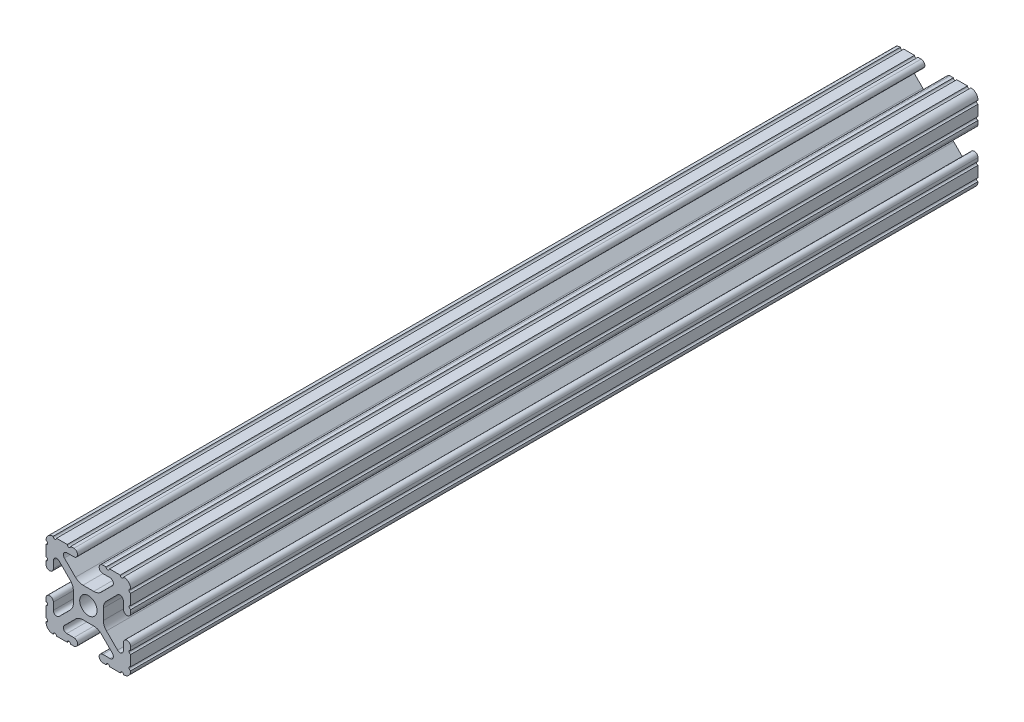
from build123d import *

# Parameters (mm, degrees)
SKETCH1_R           = 2.6035
BOSS_EXTRUDE1_DEPTH = 254


with BuildPart() as part:
    # Sketch1 → Boss-Extrude1 (new body)
    with BuildSketch(Plane(origin=(0, 0, -101.6), x_dir=(-1, 0, 0), z_dir=(0, 0, -1))):
        with BuildLine():
            Line((12.7, -9.5504), (12.7, -6.3330836))
            ThreePointArc((12.7, -6.3330836), (12.192, -5.8250836), (12.7, -5.3170836))
            Line((12.7, -5.3170836), (12.7, -4.3434))
            ThreePointArc((12.7, -4.3434), (11.5951, -3.2385), (10.4902, -4.3434))
            Line((10.4902, -4.3434), (10.4902, -6.474794456))
            ThreePointArc((10.4902, -6.474794456), (9.863006367, -7.413456061), (8.75577951, -7.193214945))
            Line((8.75577951, -7.193214945), (5.42573597, -3.863171405))
            ThreePointArc((5.42573597, -3.863171405), (4.737482484, -2.833127272), (4.4958, -1.618107374))
            Line((4.4958, -1.618107374), (4.4958, 1.618107374))
            ThreePointArc((4.4958, 1.618107374), (4.737482484, 2.833127272), (5.42573597, 3.863171405))
            Line((5.42573597, 3.863171405), (8.75577951, 7.193214945))
            ThreePointArc((8.75577951, 7.193214945), (9.863006367, 7.413456061), (10.4902, 6.474794456))
            Line((10.4902, 6.474794456), (10.4902, 4.343399971))
            ThreePointArc((10.4902, 4.343399971), (11.5951, 3.238499971), (12.7, 4.343399971))
            Line((12.7, 4.343399971), (12.7, 5.3170836))
            ThreePointArc((12.7, 5.3170836), (12.192, 5.8250836), (12.7, 6.3330836))
            Line((12.7, 6.3330836), (12.7, 9.5504))
            ThreePointArc((12.7, 9.5504), (12.192000006, 10.058323491), (12.699846982, 10.566399977))
            ThreePointArc((12.699846982, 10.566399977), (12.082522516, 12.082522516), (10.566399977, 12.699846982))
            ThreePointArc((10.566399977, 12.699846982), (10.058323491, 12.192000006), (9.5504, 12.7))
            Line((9.5504, 12.7), (6.3330836, 12.7))
            ThreePointArc((6.3330836, 12.7), (5.8250836, 12.192), (5.3170836, 12.7))
            Line((5.3170836, 12.7), (4.3434, 12.7))
            ThreePointArc((4.3434, 12.7), (3.2385, 11.5951), (4.3434, 10.4902))
            Line((4.3434, 10.4902), (6.474794456, 10.4902))
            ThreePointArc((6.474794456, 10.4902), (7.413456061, 9.863006367), (7.193214945, 8.75577951))
            Line((7.193214945, 8.75577951), (3.863171405, 5.42573597))
            ThreePointArc((3.863171405, 5.42573597), (2.833127272, 4.737482484), (1.618107374, 4.4958))
            Line((1.618107374, 4.4958), (-1.618107374, 4.4958))
            ThreePointArc((-1.618107374, 4.4958), (-2.833127272, 4.737482484), (-3.863171405, 5.42573597))
            Line((-3.863171405, 5.42573597), (-7.193214945, 8.75577951))
            ThreePointArc((-7.193214945, 8.75577951), (-7.413456061, 9.863006367), (-6.474794456, 10.4902))
            Line((-6.474794456, 10.4902), (-4.343399971, 10.4902))
            ThreePointArc((-4.343399971, 10.4902), (-3.238499971, 11.5951), (-4.343399971, 12.7))
            Line((-4.343399971, 12.7), (-5.3170836, 12.7))
            ThreePointArc((-5.3170836, 12.7), (-5.8250836, 12.192), (-6.3330836, 12.7))
            Line((-6.3330836, 12.7), (-9.5504, 12.7))
            ThreePointArc((-9.5504, 12.7), (-10.058323491, 12.192000006), (-10.566399977, 12.699846982))
            ThreePointArc((-10.566399977, 12.699846982), (-12.082522516, 12.082522516), (-12.699846982, 10.566399977))
            ThreePointArc((-12.699846982, 10.566399977), (-12.192000006, 10.058323491), (-12.7, 9.5504))
            Line((-12.7, 9.5504), (-12.7, 6.3330836))
            ThreePointArc((-12.7, 6.3330836), (-12.192, 5.8250836), (-12.7, 5.3170836))
            Line((-12.7, 5.3170836), (-12.7, 4.3434))
            ThreePointArc((-12.7, 4.3434), (-11.5951, 3.2385), (-10.4902, 4.3434))
            Line((-10.4902, 4.3434), (-10.4902, 6.474794456))
            ThreePointArc((-10.4902, 6.474794456), (-9.863006367, 7.413456061), (-8.75577951, 7.193214945))
            Line((-8.75577951, 7.193214945), (-5.42573597, 3.863171405))
            ThreePointArc((-5.42573597, 3.863171405), (-4.737482484, 2.833127272), (-4.4958, 1.618107374))
            Line((-4.4958, 1.618107374), (-4.4958, -1.618107374))
            ThreePointArc((-4.4958, -1.618107374), (-4.737482484, -2.833127272), (-5.42573597, -3.863171405))
            Line((-5.42573597, -3.863171405), (-8.75577951, -7.193214945))
            ThreePointArc((-8.75577951, -7.193214945), (-9.863006367, -7.413456061), (-10.4902, -6.474794456))
            Line((-10.4902, -6.474794456), (-10.4902, -4.343399971))
            ThreePointArc((-10.4902, -4.343399971), (-11.5951, -3.238499971), (-12.7, -4.343399971))
            Line((-12.7, -4.343399971), (-12.7, -5.3170836))
            ThreePointArc((-12.7, -5.3170836), (-12.192, -5.8250836), (-12.7, -6.3330836))
            Line((-12.7, -6.3330836), (-12.7, -9.5504))
            ThreePointArc((-12.7, -9.5504), (-12.192000006, -10.058323491), (-12.699846982, -10.566399977))
            ThreePointArc((-12.699846982, -10.566399977), (-12.082522516, -12.082522516), (-10.566399977, -12.699846982))
            ThreePointArc((-10.566399977, -12.699846982), (-10.058323491, -12.192000006), (-9.5504, -12.7))
            Line((-9.5504, -12.7), (-6.3330836, -12.7))
            ThreePointArc((-6.3330836, -12.7), (-5.8250836, -12.192), (-5.3170836, -12.7))
            Line((-5.3170836, -12.7), (-4.3434, -12.7))
            ThreePointArc((-4.3434, -12.7), (-3.2385, -11.5951), (-4.3434, -10.4902))
            Line((-4.3434, -10.4902), (-6.474794456, -10.4902))
            ThreePointArc((-6.474794456, -10.4902), (-7.413456061, -9.863006367), (-7.193214945, -8.75577951))
            Line((-7.193214945, -8.75577951), (-3.863171405, -5.42573597))
            ThreePointArc((-3.863171405, -5.42573597), (-2.833127272, -4.737482484), (-1.618107374, -4.4958))
            Line((-1.618107374, -4.4958), (1.618107374, -4.4958))
            ThreePointArc((1.618107374, -4.4958), (2.833127272, -4.737482484), (3.863171405, -5.42573597))
            Line((3.863171405, -5.42573597), (7.193214945, -8.75577951))
            ThreePointArc((7.193214945, -8.75577951), (7.413456061, -9.863006367), (6.474794456, -10.4902))
            Line((6.474794456, -10.4902), (4.343399971, -10.4902))
            ThreePointArc((4.343399971, -10.4902), (3.238499971, -11.5951), (4.343399971, -12.7))
            Line((4.343399971, -12.7), (5.3170836, -12.7))
            ThreePointArc((5.3170836, -12.7), (5.8250836, -12.192), (6.3330836, -12.7))
            Line((6.3330836, -12.7), (9.5504, -12.7))
            ThreePointArc((9.5504, -12.7), (10.058323491, -12.192000006), (10.566399977, -12.699846982))
            ThreePointArc((10.566399977, -12.699846982), (12.082522516, -12.082522516), (12.699846982, -10.566399977))
            ThreePointArc((12.699846982, -10.566399977), (12.192000006, -10.058323491), (12.7, -9.5504))
        make_face()
        with Locations(Location((0, 0, 0), (0, 0, 180))):
            Circle(SKETCH1_R, mode=Mode.SUBTRACT)
    extrude(amount=-BOSS_EXTRUDE1_DEPTH)


solid = part.part
